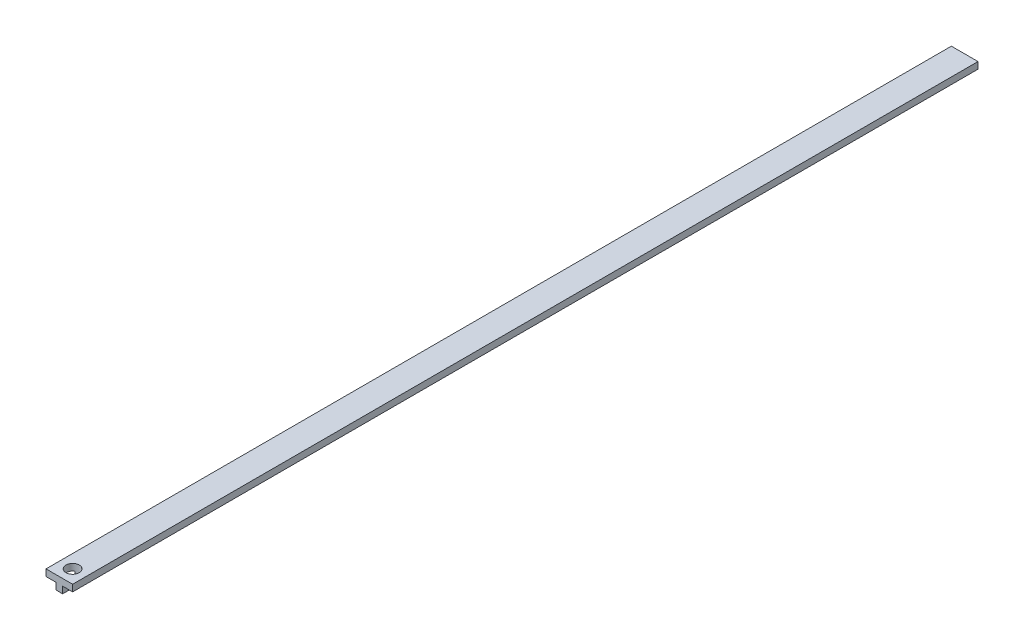
from build123d import *

# Parameters (mm, degrees)
BOSS_EXTRUDE1_DEPTH = 215.9
SKETCH4_R           = 3.175
CUT_EXTRUDE1_DEPTH  = 217.086683995


with BuildPart() as part:
    # Sketch3 → Boss-Extrude1 (new, symmetric)
    with BuildSketch(Plane.XY):
        Polygon((-6.35, 3.175), (6.35, 3.175), (6.35, 0), (1.5875, 0), (1.5875, -3.175), (-1.5875, -3.175), (-1.5875, 0), (-6.35, 0), align=None)
    extrude(amount=BOSS_EXTRUDE1_DEPTH, both=True)

    # Sketch4 → Cut-Extrude1 (cut, through all)
    with BuildSketch(Plane(origin=(0, 3.175, 0), x_dir=(1, 0, 0), z_dir=(0, 1, 0))):
        with Locations(Location((0, -209.55, 0), (0, 0, 180))):
            Circle(SKETCH4_R)
    extrude(amount=-CUT_EXTRUDE1_DEPTH, mode=Mode.SUBTRACT)


solid = part.part
